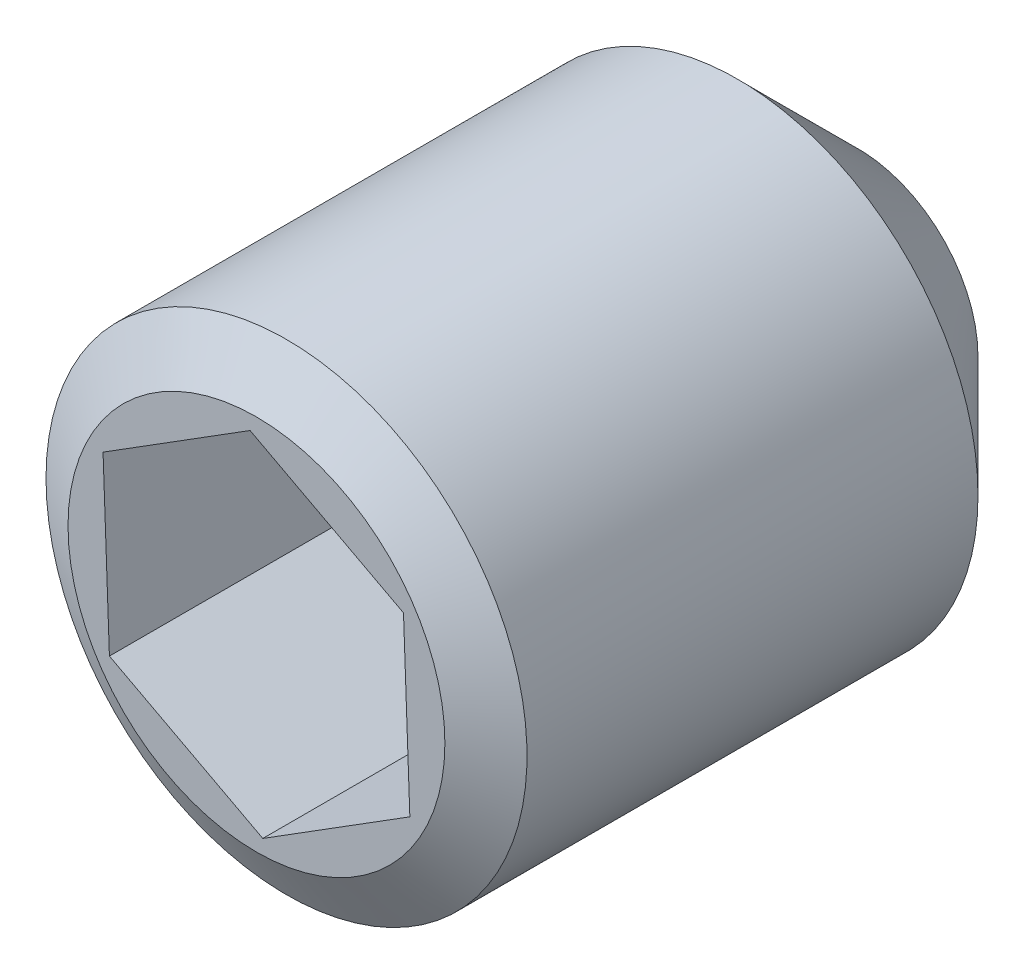
from build123d import *

# Parameters (mm, degrees)
ESBO_O1_R                = 4
RESSALTO_EXTRUS_O1_DEPTH = 10
CORTE_EXTRUS_O1_DEPTH    = 6
CHANFRO3_SIZE            = 0.5
CHANFRO3_SIZE2           = 0.866025404
CHANFRO4_SIZE            = 2


with BuildPart() as part:
    # Esboço1 → Ressalto-extrusão1 (new body)
    with BuildSketch(Plane.XY):
        Circle(ESBO_O1_R)
    extrude(amount=RESSALTO_EXTRUS_O1_DEPTH)

    # Esboço2 → Corte-extrusão1 (cut)
    with BuildSketch(Plane.XY.offset(10)):
        Polygon((-0.105817982, 2.88481124), (-2.55122881, 1.350764559), (-2.445410828, -1.53404668), (0.105817982, -2.88481124), (2.55122881, -1.350764559), (2.445410828, 1.53404668), align=None)
    extrude(amount=-CORTE_EXTRUS_O1_DEPTH, mode=Mode.SUBTRACT)

    # Chanfro3
    chanfro3_edges = [part.edges().sort_by_distance(p)[0] for p in [
        (-4, 0, 10),
    ]]
    chanfro3_side = [part.faces().sort_by_distance(p)[0] for p in [
        (-4, 0, 5),
    ]]
    chamfer(chanfro3_edges, length=CHANFRO3_SIZE, length2=CHANFRO3_SIZE2, reference=chanfro3_side[0])

    # Chanfro4
    chanfro4_edges = [part.edges().sort_by_distance(p)[0] for p in [
        (-4, 0, 0),
    ]]
    chamfer(chanfro4_edges, length=CHANFRO4_SIZE)


solid = part.part
